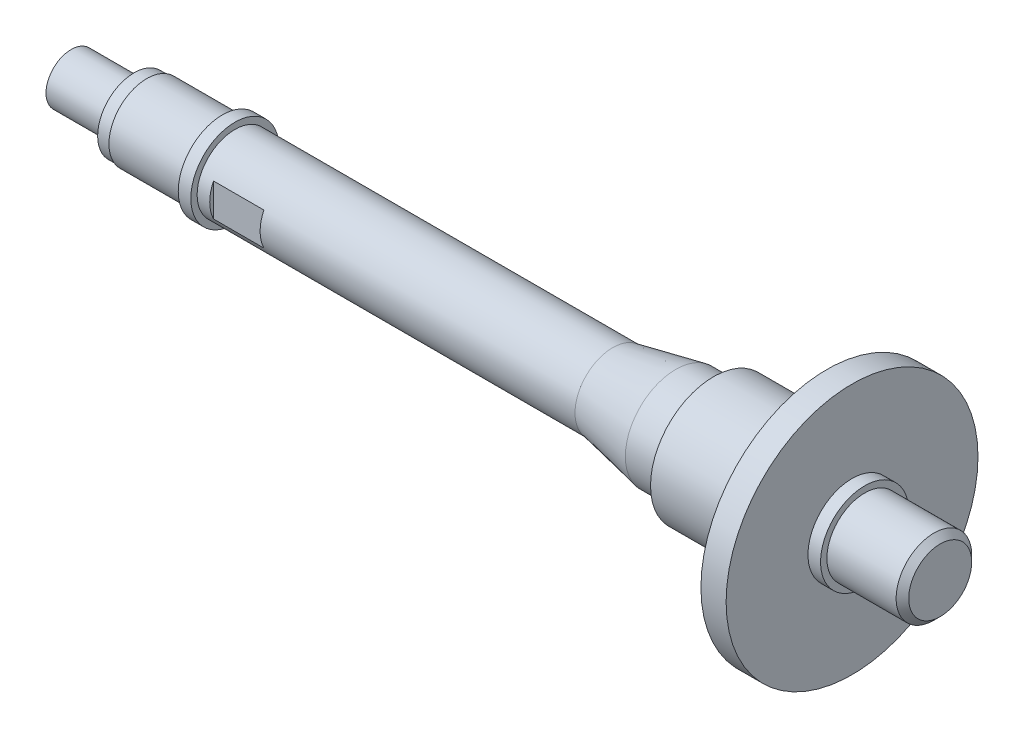
from build123d import *

# Parameters (mm, degrees)
SKETCH_1_R          = 10
EXTRUDE_1_DEPTH     = 2
SKETCH_2_R          = 3.5
EXTRUDE_2_DEPTH     = 1
SKETCH_3_R          = 6
EXTRUDE_3_DEPTH     = 9
SKETCH_4_R          = 4
EXTRUDE_4_DEPTH     = 3
SKETCH_5_R          = 3
EXTRUDE_5_DEPTH     = 6
EXTRUDE_START       = 35
SKETCH_6_R          = 3
EXTRUDE_6_DEPTH     = 35
EXTRUDE_START_2     = 1
SKETCH_7_R          = 3.5
EXTRUDE_7_DEPTH     = 1
EXTRUDE_START_3     = 9
SKETCH_8_R          = 3
EXTRUDE_8_DEPTH     = 9
SKETCH_9_R          = 2
EXTRUDE_9_DEPTH     = 3
CHAMFER_1_SIZE      = 0.5
SKETCH_11_W         = 4
SKETCH_11_H         = 0.3
CUT_EXTRUDE_2_DEPTH = 5
CUT_EXTRUDE_START   = 2
SKETCH_12_R         = 6
SKETCH_12_R_2       = 4.5
CUT_EXTRUDE_3_DEPTH = 1
CUT_EXTRUDE_START_2 = -6
SKETCH_13_R         = 6
SKETCH_13_R_2       = 5
CUT_EXTRUDE_4_DEPTH = 6
SKETCH_15_R         = 3
SKETCH_15_R_2       = 2.9
CUT_EXTRUDE_5_DEPTH = 3
SKETCH_16_R         = 2.9
SKETCH_16_R_2       = 2
CUT_EXTRUDE_8_DEPTH = 2


with BuildPart() as part:
    # 草图1 → 凸台-拉伸1 (new body)
    with BuildSketch(Plane(origin=(0, 0, 0), x_dir=(0, 0, -1), z_dir=(1, 0, 0))):
        Circle(SKETCH_1_R)
    extrude(amount=EXTRUDE_1_DEPTH)

    # 草图2 → 凸台-拉伸2 (add)
    with BuildSketch(Plane(origin=(2, 0, 0), x_dir=(0, 0, -1), z_dir=(1, 0, 0))):
        Circle(SKETCH_2_R)
    extrude(amount=EXTRUDE_2_DEPTH)

    # 草图3 → 凸台-拉伸3 (add)
    with BuildSketch(Plane.ZY):
        with Locations(Location((0, 0, 0), (0, 0, 180))):
            Circle(SKETCH_3_R)
    extrude(amount=EXTRUDE_3_DEPTH)

    # 草图4 → 凸台-拉伸4 (add)
    with BuildSketch(Plane.ZY.offset(9)):
        Circle(SKETCH_4_R)
    extrude(amount=EXTRUDE_4_DEPTH)

    # 草图5 → 凸台-拉伸5 (add)
    with BuildSketch(Plane(origin=(3, 0, 0), x_dir=(0, 0, -1), z_dir=(1, 0, 0))):
        Circle(SKETCH_5_R)
    extrude(amount=EXTRUDE_5_DEPTH)

    # 草图6 → 凸台-拉伸6 (add)
    with BuildSketch(Plane.ZY.offset(12).offset(EXTRUDE_START)):
        with Locations(Location((0, 0, 0), (0, 0, 180))):
            Circle(SKETCH_6_R)
    extrude(amount=-EXTRUDE_6_DEPTH)

    # 草图7 → 凸台-拉伸7 (add)
    with BuildSketch(Plane.ZY.offset(47).offset(EXTRUDE_START_2)):
        with Locations(Location((0, 0, 0), (0, 0, 180))):
            Circle(SKETCH_7_R)
    extrude(amount=-EXTRUDE_7_DEPTH)

    # 草图8 → 凸台-拉伸8 (add)
    with BuildSketch(Plane.ZY.offset(48).offset(EXTRUDE_START_3)):
        with Locations(Location((0, 0, 0), (0, 0, 180))):
            Circle(SKETCH_8_R)
    extrude(amount=-EXTRUDE_8_DEPTH)

    # 草图9 → 凸台-拉伸9 (add)
    with BuildSketch(Plane.ZY.offset(57)):
        Circle(SKETCH_9_R)
    extrude(amount=EXTRUDE_9_DEPTH)

    # 倒角1
    chamfer_1_edges = [part.edges().sort_by_distance(p)[0] for p in [
        (9, 0, 3),
    ]]
    chamfer(chamfer_1_edges, length=CHAMFER_1_SIZE)

    # 草图11 → 切除-拉伸2 (cut, symmetric)
    with BuildSketch(Plane(origin=(0, 0, 0), x_dir=(1, 0, 0), z_dir=(0, 1, 0))):
        with Locations((-44, 2.85)):
            Rectangle(SKETCH_11_W, SKETCH_11_H)
        with Locations((-44, -2.85)):
            Rectangle(SKETCH_11_W, SKETCH_11_H)
    extrude(amount=CUT_EXTRUDE_2_DEPTH, both=True, mode=Mode.SUBTRACT)

    # 草图12 → 切除-拉伸3 (cut)
    with BuildSketch(Plane.ZY.offset(CUT_EXTRUDE_START)):
        Circle(SKETCH_12_R)
        Circle(SKETCH_12_R_2, mode=Mode.SUBTRACT)
    extrude(amount=CUT_EXTRUDE_3_DEPTH, mode=Mode.SUBTRACT)

    # 草图13 → 切除-拉伸4 (cut)
    with BuildSketch(Plane.ZY.offset(9).offset(CUT_EXTRUDE_START_2)):
        with Locations(Location((0, 0, 0), (0, 0, 180))):
            Circle(SKETCH_13_R)
        Circle(SKETCH_13_R_2, mode=Mode.SUBTRACT)
    extrude(amount=CUT_EXTRUDE_4_DEPTH, mode=Mode.SUBTRACT)

    # 草图14 → 旋转1 (revolve)
    with BuildSketch(Plane.XY, mode=Mode.PRIVATE) as revolve_1_sk:
        Polygon((-12, 4), (-17, 3), (-12, 3), align=None)
    revolve(revolve_1_sk.sketch.rotate(Axis((-6.238584256, 0, 0), (-1, 0, 0)), 90), axis=Axis((-6.238584256, 0, 0), (-1, 0, 0)))

    # 草图15 → 切除-拉伸5 (cut)
    with BuildSketch(Plane.ZY.offset(57)):
        Circle(SKETCH_15_R)
        Circle(SKETCH_15_R_2, mode=Mode.SUBTRACT)
    extrude(amount=-CUT_EXTRUDE_5_DEPTH, mode=Mode.SUBTRACT)

    # 草图16 → 切除-拉伸8 (cut)
    with BuildSketch(Plane.ZY.offset(57)):
        Circle(SKETCH_16_R)
        Circle(SKETCH_16_R_2, mode=Mode.SUBTRACT)
    extrude(amount=-CUT_EXTRUDE_8_DEPTH, mode=Mode.SUBTRACT)


solid = part.part
